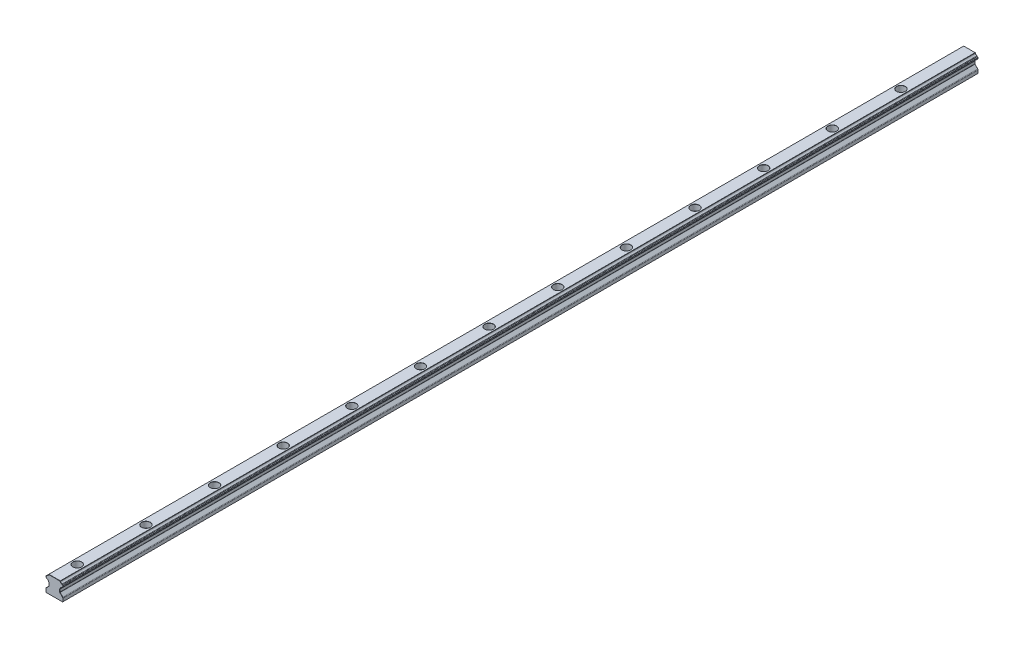
from build123d import *

# Parameters (mm, degrees)
BODY_DEPTH                                 = 800
AESTHETIC_CHAMFER_SIZE                     = 0.15
PRODUCTION_FILLET_R                        = 0.1
MOUNTING_HOLES_PATTERN_COUNT               = 13
MOUNTING_HOLES_PATTERN_PITCH               = 60
PRODUCTION_FILLET_OF_MOUNTING_HOLES_PATT_R = 0.1


with BuildPart() as part:
    # Rail Profile → Body (new body)
    with BuildSketch(Plane.XY):
        with BuildLine():
            Line((-7, 0), (7, 0))
            Line((7, 0), (7.5, 0.5))
            Line((7.5, 0.5), (7.5, 3.085786438))
            ThreePointArc((7.5, 3.085786438), (7.423879533, 3.46846987), (7.207106781, 3.792893219))
            Line((7.207106781, 3.792893219), (4.867157288, 6.132842712))
            ThreePointArc((4.867157288, 6.132842712), (4.780448187, 6.262612052), (4.75, 6.415685425))
            Line((4.75, 6.415685425), (4.75, 8.584314575))
            ThreePointArc((4.75, 8.584314575), (4.780448187, 8.737387948), (4.867157288, 8.867157288))
            Line((4.867157288, 8.867157288), (5.062965362, 9.062965362))
            ThreePointArc((5.062965362, 9.062965362), (5.134996734, 9.161242682), (5.17409812, 9.27664646))
            ThreePointArc((5.17409812, 9.27664646), (5.61862915, 10.13137085), (6.47335354, 10.57590188))
            ThreePointArc((6.47335354, 10.57590188), (6.694124352, 10.694306692), (6.801170165, 10.920803148))
            ThreePointArc((6.801170165, 10.920803148), (6.915305692, 11.154571658), (7.149074202, 11.268707185))
            ThreePointArc((7.149074202, 11.268707185), (7.399691242, 11.400760606), (7.5, 11.665685425))
            Line((7.5, 11.665685425), (7.5, 12.334314575))
            ThreePointArc((7.5, 12.334314575), (7.399691242, 12.599239394), (7.149074202, 12.731292815))
            ThreePointArc((7.149074202, 12.731292815), (6.915305692, 12.845428342), (6.801170165, 13.079196852))
            ThreePointArc((6.801170165, 13.079196852), (6.694124352, 13.305693308), (6.47335354, 13.42409812))
            ThreePointArc((6.47335354, 13.42409812), (5.61862915, 13.86862915), (5.17409812, 14.72335354))
            ThreePointArc((5.17409812, 14.72335354), (5.134996734, 14.838757318), (5.062965362, 14.937034638))
            Line((5.062965362, 14.937034638), (5, 15))
            Line((5, 15), (-5, 15))
            Line((-5, 15), (-5.062965362, 14.937034638))
            ThreePointArc((-5.062965362, 14.937034638), (-5.134996734, 14.838757318), (-5.17409812, 14.72335354))
            ThreePointArc((-5.17409812, 14.72335354), (-5.61862915, 13.86862915), (-6.47335354, 13.42409812))
            ThreePointArc((-6.47335354, 13.42409812), (-6.694124352, 13.305693308), (-6.801170165, 13.079196852))
            ThreePointArc((-6.801170165, 13.079196852), (-6.915305692, 12.845428342), (-7.149074202, 12.731292815))
            ThreePointArc((-7.149074202, 12.731292815), (-7.399691242, 12.599239394), (-7.5, 12.334314575))
            Line((-7.5, 12.334314575), (-7.5, 11.665685425))
            ThreePointArc((-7.5, 11.665685425), (-7.399691242, 11.400760606), (-7.149074202, 11.268707185))
            ThreePointArc((-7.149074202, 11.268707185), (-6.915305692, 11.154571658), (-6.801170165, 10.920803148))
            ThreePointArc((-6.801170165, 10.920803148), (-6.694124352, 10.694306692), (-6.47335354, 10.57590188))
            ThreePointArc((-6.47335354, 10.57590188), (-5.61862915, 10.13137085), (-5.17409812, 9.27664646))
            ThreePointArc((-5.17409812, 9.27664646), (-5.134996734, 9.161242682), (-5.062965362, 9.062965362))
            Line((-5.062965362, 9.062965362), (-4.867157288, 8.867157288))
            ThreePointArc((-4.867157288, 8.867157288), (-4.780448187, 8.737387948), (-4.75, 8.584314575))
            Line((-4.75, 8.584314575), (-4.75, 6.415685425))
            ThreePointArc((-4.75, 6.415685425), (-4.780448187, 6.262612052), (-4.867157288, 6.132842712))
            Line((-4.867157288, 6.132842712), (-7.207106781, 3.792893219))
            ThreePointArc((-7.207106781, 3.792893219), (-7.423879533, 3.46846987), (-7.5, 3.085786438))
            Line((-7.5, 3.085786438), (-7.5, 0.5))
            Line((-7.5, 0.5), (-7, 0))
        make_face()
    extrude(amount=-BODY_DEPTH)

    # Aesthetic Chamfer
    aesthetic_chamfer_edges = [part.edges().sort_by_distance(p)[0] for p in [
        (7.423879533, 3.46846987, -800),
        (-5.134996734, 9.161242682, -800),
        (-4.965061325, 8.965061325, -800),
        (-4.780448187, 8.737387948, -800),
        (-4.75, 7.5, -800),
        (-4.780448187, 6.262612052, -800),
        (-6.037132034, 4.962867966, -800),
        (-7.423879533, 3.46846987, -800),
        (-7.5, 1.792893219, -800),
        (-7.25, 0.25, -800),
        (0, 0, -800),
        (6.037132034, 4.962867966, -800),
        (4.780448187, 6.262612052, -800),
        (4.75, 7.5, -800),
        (4.780448187, 8.737387948, -800),
        (4.965061325, 8.965061325, -800),
        (5.134996734, 9.161242682, -800),
        (5.61862915, 10.13137085, -800),
        (6.694124352, 10.694306692, -800),
        (0, 0, 0),
        (-7.25, 0.25, 0),
        (-7.5, 1.792893219, 0),
        (-7.423879533, 3.46846987, 0),
        (-6.037132034, 4.962867966, 0),
        (-4.780448187, 6.262612052, 0),
        (6.915305692, 11.154571658, -800),
        (-4.75, 7.5, 0),
        (-4.780448187, 8.737387948, 0),
        (-4.965061325, 8.965061325, 0),
        (-5.134996734, 9.161242682, 0),
        (-5.61862915, 10.13137085, 0),
        (-6.694124352, 10.694306692, 0),
        (-6.915305692, 11.154571658, 0),
        (7.25, 0.25, -800),
        (7.399691242, 11.400760606, -800),
        (-7.399691242, 11.400760606, 0),
        (-7.5, 12, 0),
        (-7.399691242, 12.599239394, 0),
        (-6.915305692, 12.845428342, 0),
        (-6.694124352, 13.305693308, 0),
        (-5.61862915, 13.86862915, 0),
        (-5.134996734, 14.838757318, 0),
        (-5.031482681, 14.968517319, 0),
        (7.5, 12, -800),
        (0, 15, 0),
        (5.031482681, 14.968517319, 0),
        (5.134996734, 14.838757318, 0),
        (5.61862915, 13.86862915, 0),
        (6.694124352, 13.305693308, 0),
        (6.915305692, 12.845428342, 0),
        (7.399691242, 12.599239394, 0),
        (7.399691242, 12.599239394, -800),
        (7.5, 12, 0),
        (7.399691242, 11.400760606, 0),
        (6.915305692, 11.154571658, 0),
        (6.694124352, 10.694306692, 0),
        (5.61862915, 10.13137085, 0),
        (5.134996734, 9.161242682, 0),
        (4.965061325, 8.965061325, 0),
        (4.780448187, 8.737387948, 0),
        (6.915305692, 12.845428342, -800),
        (4.75, 7.5, 0),
        (4.780448187, 6.262612052, 0),
        (6.037132034, 4.962867966, 0),
        (7.423879533, 3.46846987, 0),
        (7.5, 1.792893219, 0),
        (7.25, 0.25, 0),
        (6.694124352, 13.305693308, -800),
        (5.61862915, 13.86862915, -800),
        (5.134996734, 14.838757318, -800),
        (5.031482681, 14.968517319, -800),
        (0, 15, -800),
        (-5.031482681, 14.968517319, -800),
        (7.5, 1.792893219, -800),
        (-5.134996734, 14.838757318, -800),
        (-5.61862915, 13.86862915, -800),
        (-6.694124352, 13.305693308, -800),
        (-6.915305692, 12.845428342, -800),
        (-7.399691242, 12.599239394, -800),
        (-7.5, 12, -800),
        (-7.399691242, 11.400760606, -800),
        (-6.915305692, 11.154571658, -800),
        (-6.694124352, 10.694306692, -800),
        (-5.61862915, 10.13137085, -800),
    ]]
    chamfer(aesthetic_chamfer_edges, length=AESTHETIC_CHAMFER_SIZE)

    # Sketch1 → Mounting Hole (revolve, cut)
    with BuildSketch(Plane(origin=(0, 15, -20), x_dir=(0, 0, 1), z_dir=(1, 0, 0))):
        Polygon((0, 0), (0, 15), (2.35, 15), (2.25, 14.9), (2.25, 5.4), (2.35, 5.3), (3.75, 5.3), (3.75, 0.1), (3.85, 0), align=None)
    mounting_hole = revolve(axis=Axis((0, 21.35, -20), (0, -1, 0)), mode=Mode.SUBTRACT)

    # Production Fillet
    production_fillet_edges = [part.edges().sort_by_distance(p)[0] for p in [
        (0, 9.7, -23.75),
    ]]
    fillet(production_fillet_edges, radius=PRODUCTION_FILLET_R)

    # Mounting Holes Pattern: Mounting Hole ×13
    with Locations(*[(0, 0, -i * MOUNTING_HOLES_PATTERN_PITCH) for i in range(1, MOUNTING_HOLES_PATTERN_COUNT)]):
        add(mounting_hole, mode=Mode.SUBTRACT)

    # Production Fillet of Mounting Holes Patt
    production_fillet_of_mounting_holes_patt_edges = [part.edges().sort_by_distance(p)[0] for p in [
        (0, 9.7, -83.75),
        (0, 9.7, -143.75),
        (0, 9.7, -203.75),
        (0, 9.7, -263.75),
        (0, 9.7, -323.75),
        (0, 9.7, -383.75),
        (0, 9.7, -443.75),
        (0, 9.7, -503.75),
        (0, 9.7, -563.75),
        (0, 9.7, -623.75),
        (0, 9.7, -683.75),
        (0, 9.7, -743.75),
    ]]
    fillet(production_fillet_of_mounting_holes_patt_edges, radius=PRODUCTION_FILLET_OF_MOUNTING_HOLES_PATT_R)


solid = part.part
